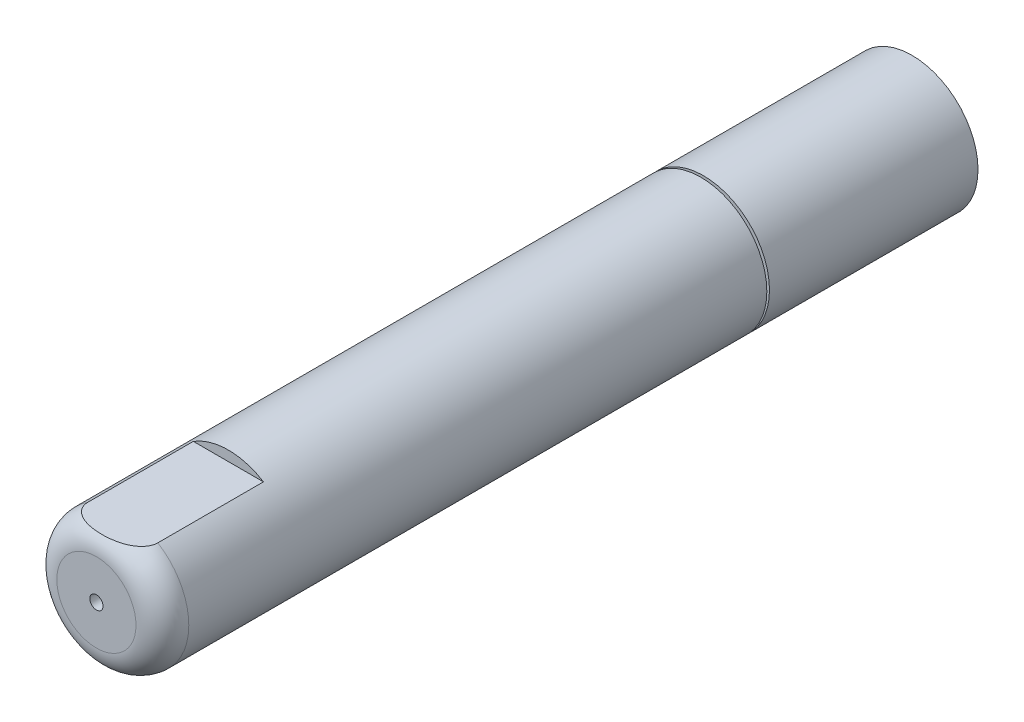
from build123d import *

# Parameters (mm, degrees)
SKETCH3_R          = 0.25
CUT_EXTRUDE1_DEPTH = 50
FILLET1_R          = 1
CUT_EXTRUDE2_START = -5
CUT_EXTRUDE2_DEPTH = 5


with BuildPart() as part:
    # Sketch1 → Revolve1 (revolve)
    with BuildSketch(Plane(origin=(0, 0, 0), x_dir=(0, 0, -1), z_dir=(1, 0, 0)), mode=Mode.PRIVATE) as revolve1_sk:
        Polygon((24.740167046, 48.133333333), (47.640167046, 48.133333333), (47.640167046, 47.633333333), (47.740167046, 47.633333333), (47.740167046, 48.133333333), (50.640167046, 48.133333333), (52.640167046, 48.133333333), (55.640167046, 48.133333333), (55.640167046, 45.633333333), (24.740167046, 45.633333333), align=None)
    revolve(revolve1_sk.sketch.rotate(Axis((0, 45.633333333, -15.940167046), (0, 0, -1)), 90), axis=Axis((0, 45.633333333, -15.940167046), (0, 0, -1)))

    # Sketch3 → Cut-Extrude1 (cut)
    with BuildSketch(Plane.XY.offset(-24.740167046)):
        with Locations((0, 45.633333333)):
            Circle(SKETCH3_R)
    extrude(amount=-CUT_EXTRUDE1_DEPTH, mode=Mode.SUBTRACT)

    # Fillet1
    fillet1_edges = [part.edges().sort_by_distance(p)[0] for p in [
        (-2.5, 45.633333333, -24.740167046),
    ]]
    fillet(fillet1_edges, radius=FILLET1_R)

    # Sketch2 → Cut-Extrude2 (cut)
    with BuildSketch(Plane.XY.offset(-24.740167046).offset(CUT_EXTRUDE2_START)):
        with BuildLine():
            Line((-1.328346703, 47.751232065), (1.328346703, 47.751232065))
            ThreePointArc((1.328346703, 47.751232065), (0.691105336, 48.035909745), (0, 48.133333333))
            ThreePointArc((0, 48.133333333), (-0.691105336, 48.035909745), (-1.328346703, 47.751232065))
        make_face()
    extrude(amount=CUT_EXTRUDE2_DEPTH, mode=Mode.SUBTRACT)


solid = part.part
